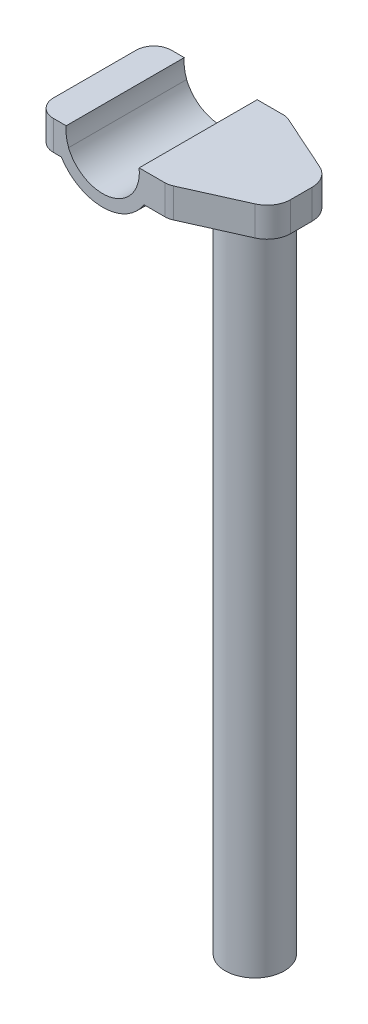
from build123d import *

# Parameters (mm, degrees)
BOSS_EXTRUDE1_DEPTH  = 20
SKETCH3_OUTSIDE_W    = 88.614
SKETCH3_OUTSIDE_H    = 38.614
CUT_EXTRUDE2_DEPTH   = 57.789083458
BOSS_EXTRUDE3_START  = 20
SKETCH4_R            = 10
BOSS_EXTRUDE3_DEPTH  = 225
BOSS_EXTRUDE22_DEPTH = 6
SKETCH47_R           = 12.424441969
CUT_EXTRUDE8_DEPTH   = 212.778185845


with BuildPart() as part:
    # Sketch2 → Boss-Extrude1 (new body)
    with BuildSketch(Plane(origin=(0, 0, 0), x_dir=(1, 0, 0), z_dir=(0, 1, 0))):
        with BuildLine():
            Line((-35, -14), (-35, 14))
            ThreePointArc((-35, 14), (-33.242640687, 18.242640687), (-29, 20))
            Line((-29, 20), (8.717414306, 20))
            ThreePointArc((8.717414306, 20), (9.971663529, 19.867440574), (11.1704919, 19.475619629))
            Line((11.1704919, 19.475619629), (30.270770125, 10.918694984))
            ThreePointArc((30.270770125, 10.918694984), (33.714393532, 7.967227328), (35, 3.617868812))
            Line((35, 3.617868812), (35, -3.617868812))
            ThreePointArc((35, -3.617868812), (33.714393532, -7.967227328), (30.270770125, -10.918694984))
            Line((30.270770125, -10.918694984), (11.1704919, -19.475619629))
            ThreePointArc((11.1704919, -19.475619629), (9.971663529, -19.867440574), (8.717414306, -20))
            Line((8.717414306, -20), (-29, -20))
            ThreePointArc((-29, -20), (-33.242640687, -18.242640687), (-35, -14))
        make_face()
    extrude(amount=BOSS_EXTRUDE1_DEPTH)

    # Sketch3 outside → Cut-Extrude2 (cut, through all)
    with BuildSketch(Plane.XY.offset(20)):
        with Locations((0, 10)):
            Rectangle(SKETCH3_OUTSIDE_W, SKETCH3_OUTSIDE_H)
        with BuildLine():
            Line((-35, 20), (-23.9, 20))
            ThreePointArc((-23.9, 20), (-12.33766892, 12.25), (-0.77533784, 20))
            Line((-0.77533784, 20), (35, 20))
            Line((35, 20), (35, 16))
            Line((35, 16), (1.651165913, 16))
            ThreePointArc((1.651165913, 16), (-12.33766892, 8.25), (-26.326503754, 16))
            Line((-26.326503754, 16), (-35, 16))
            Line((-35, 16), (-35, 20))
        make_face(mode=Mode.SUBTRACT)
    extrude(amount=-CUT_EXTRUDE2_DEPTH, mode=Mode.SUBTRACT)



with BuildPart() as body_2:
    # Sketch4 → Boss-Extrude3 (new body)
    with BuildSketch(Plane(origin=(0, 0, 0), x_dir=(1, 0, 0), z_dir=(0, 1, 0)).offset(BOSS_EXTRUDE3_START)):
        with Locations(Location((19.22466216, 0, 0), (0, 0, 90))):
            Circle(SKETCH4_R)
    extrude(amount=-BOSS_EXTRUDE3_DEPTH)


with BuildPart() as part_1:
    add(part.part)

    add(body_2.part)  # Boss-Extrude22 merges body 2
    # Sketch46 → Boss-Extrude22 (add)
    with BuildSketch(Plane(origin=(0, 20, 0), x_dir=(1, 0, 0), z_dir=(0, 1, 0))):
        with BuildLine():
            Line((8.717414306, 20), (-29, 20))
            ThreePointArc((-29, 20), (-33.242640687, 18.242640687), (-35, 14))
            Line((-35, 14), (-35, -14))
            ThreePointArc((-35, -14), (-33.242640687, -18.242640687), (-29, -20))
            Line((-29, -20), (8.717414306, -20))
            ThreePointArc((8.717414306, -20), (9.971663529, -19.867440574), (11.1704919, -19.475619629))
            Line((11.1704919, -19.475619629), (30.270770125, -10.918694984))
            ThreePointArc((30.270770125, -10.918694984), (33.714393532, -7.967227328), (35, -3.617868812))
            Line((35, -3.617868812), (35, 3.617868812))
            ThreePointArc((35, 3.617868812), (33.714393532, 7.967227328), (30.270770125, 10.918694984))
            Line((30.270770125, 10.918694984), (11.1704919, 19.475619629))
            ThreePointArc((11.1704919, 19.475619629), (9.971663529, 19.867440574), (8.717414306, 20))
        make_face()
    extrude(amount=BOSS_EXTRUDE22_DEPTH)

    # Sketch47 → Cut-Extrude8 (cut, through all)
    with BuildSketch(Plane.XY.offset(20)):
        with Locations((-12.32630139, 24.675301972)):
            Circle(SKETCH47_R)
    extrude(amount=-CUT_EXTRUDE8_DEPTH, mode=Mode.SUBTRACT)


solid = part_1.part
